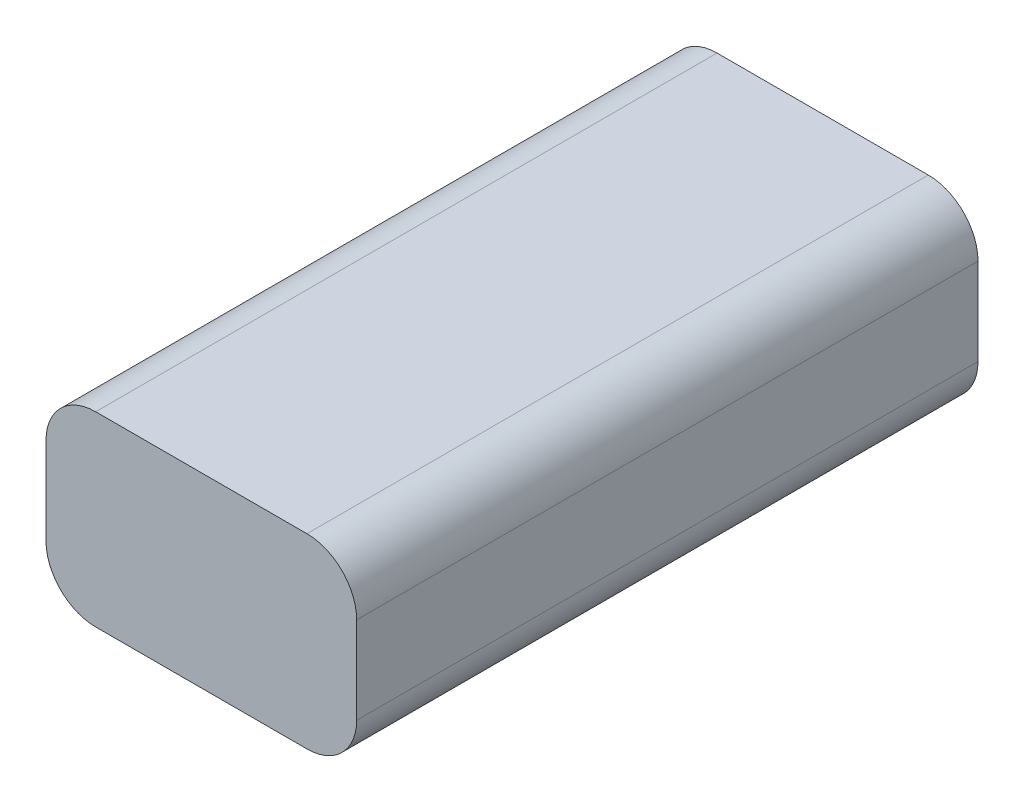
from build123d import *

# Parameters (mm, degrees)
SKETCH_1_W      = 50
SKETCH_1_H      = 100
EXTRUDE_1_DEPTH = 30
FILLET_1_R      = 8


with BuildPart() as part:
    # 草图1 → 凸台-拉伸1 (new body)
    with BuildSketch(Plane(origin=(0, 0, 0), x_dir=(1, 0, 0), z_dir=(0, 1, 0))):
        Rectangle(SKETCH_1_W, SKETCH_1_H)
    extrude(amount=EXTRUDE_1_DEPTH)

    # 圆角1
    fillet_1_edges = [part.edges().sort_by_distance(p)[0] for p in [
        (-25, 30, 0),
        (25, 30, 0),
        (-25, 0, 0),
        (25, 0, 0),
    ]]
    fillet(fillet_1_edges, radius=FILLET_1_R)


solid = part.part
